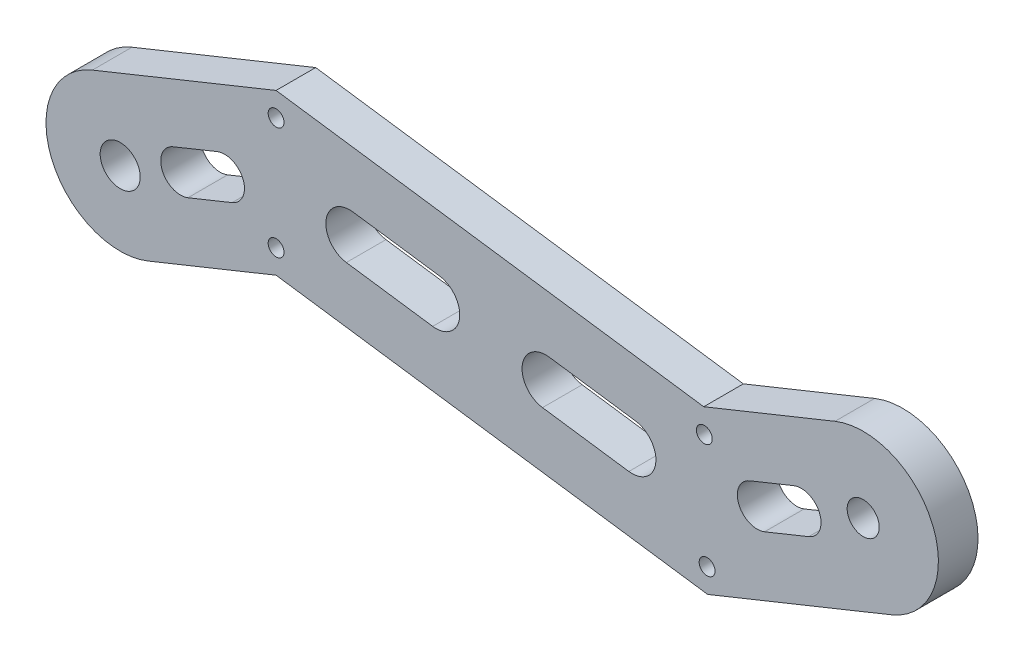
from build123d import *

# Parameters (mm, degrees)
SKETCH2_R           = 5.05
SKETCH2_R_2         = 4.05
SKETCH2_R_3         = 2
BOSS_EXTRUDE1_DEPTH = 10


with BuildPart() as part:
    # Sketch2 → Boss-Extrude1 (new body)
    with BuildSketch(Plane.XY):
        with BuildLine():
            Line((-52.525602652, 39.073613719), (55.40832582, 23.904489319))
            Line((55.40832582, 23.904489319), (88.545070057, 37.292603029))
            ThreePointArc((88.545070057, 37.292603029), (113.24947567, 26.806204997), (102.763077638, 2.101799383))
            Line((102.763077638, 2.101799383), (56.40388491, -16.628530288))
            Line((56.40388491, -16.628530288), (-52.525602652, -1.319489182))
            Line((-52.525602652, -1.319489182), (-84.855091861, -14.38145069))
            ThreePointArc((-84.855091861, -14.38145069), (-109.23231099, -4.033935081), (-98.88479538, 20.343284048))
            Line((-98.88479538, 20.343284048), (-52.525602652, 39.073613719))
        make_face()
        with Locations((-91.869943621, 2.980916679)):
            Circle(SKETCH2_R, mode=Mode.SUBTRACT)
        with Locations((95.654073847, 19.697201206)):
            Circle(SKETCH2_R_2, mode=Mode.SUBTRACT)
        with Locations((-52.525602652, 33.073613719)):
            Circle(SKETCH2_R_3, mode=Mode.SUBTRACT)
        with Locations((55.555695905, 17.904489319)):
            Circle(SKETCH2_R_3, mode=Mode.SUBTRACT)
        with Locations((-52.525602652, 4.680510818)):
            Circle(SKETCH2_R_3, mode=Mode.SUBTRACT)
        with Locations((56.256514825, -10.628530288)):
            Circle(SKETCH2_R_3, mode=Mode.SUBTRACT)
        with BuildLine():
            Line((-33.124360513, 22.209360939), (-11.338463, 19.147552718))
            ThreePointArc((-11.338463, 19.147552718), (-6.231893194, 12.3709057), (-13.008540212, 7.264335893))
            Line((-13.008540212, 7.264335893), (-34.794437724, 10.326144114))
            ThreePointArc((-34.794437724, 10.326144114), (-39.901007531, 17.102791132), (-33.124360513, 22.209360939))
        make_face(mode=Mode.SUBTRACT)
        with BuildLine():
            Line((-78.505415838, 13.773210112), (-67.379209583, 18.268489233))
            ThreePointArc((-67.379209583, 18.268489233), (-60.870257343, 15.505602928), (-63.633143649, 8.996650688))
            Line((-63.633143649, 8.996650688), (-74.759349904, 4.501371567))
            ThreePointArc((-74.759349904, 4.501371567), (-81.268302144, 7.264257873), (-78.505415838, 13.773210112))
        make_face(mode=Mode.SUBTRACT)
        with BuildLine():
            Line((67.013646361, 13.518391096), (78.139852616, 18.013670217))
            ThreePointArc((78.139852616, 18.013670217), (84.648804856, 15.250783911), (81.88591855, 8.741831672))
            Line((81.88591855, 8.741831672), (70.759712296, 4.246552551))
            ThreePointArc((70.759712296, 4.246552551), (64.250760056, 7.009438856), (67.013646361, 13.518391096))
        make_face(mode=Mode.SUBTRACT)
        with BuildLine():
            Line((16.389042924, 15.250705891), (38.174940437, 12.18889767))
            ThreePointArc((38.174940437, 12.18889767), (43.281510244, 5.412250652), (36.504863225, 0.305680845))
            Line((36.504863225, 0.305680845), (14.718965713, 3.367489066))
            ThreePointArc((14.718965713, 3.367489066), (9.612395906, 10.144136084), (16.389042924, 15.250705891))
        make_face(mode=Mode.SUBTRACT)
    extrude(amount=BOSS_EXTRUDE1_DEPTH)


solid = part.part
